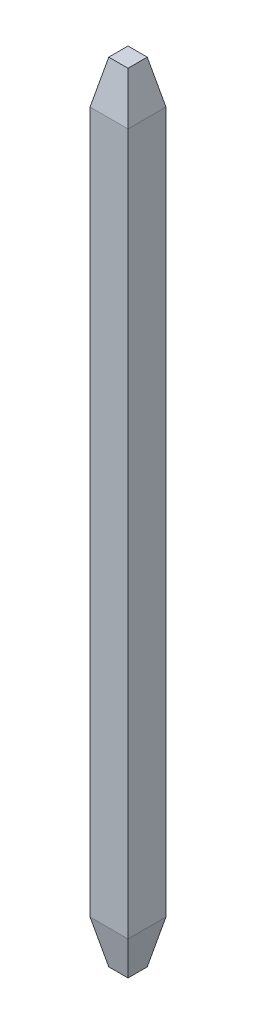
from build123d import *
from OCP.BRepFilletAPI import BRepFilletAPI_MakeChamfer

# Parameters (mm, degrees)
SKETCH1_W           = 0.65
SKETCH1_H           = 0.65
BOSS_EXTRUDE1_DEPTH = 13.5
CHAMFER1_SIZE       = 0.74
CHAMFER1_SIZE2      = 0.16
CHAMFER2_SIZE       = 0.16
CHAMFER2_SIZE2      = 0.74


with BuildPart() as part:
    # Sketch1 → Boss-Extrude1 (new body)
    with BuildSketch(Plane(origin=(0, 0, 0), x_dir=(1, 0, 0), z_dir=(0, 1, 0))):
        with Locations((0.325, 0.325)):
            Rectangle(SKETCH1_W, SKETCH1_H)
    extrude(amount=BOSS_EXTRUDE1_DEPTH)

    # Chamfer1: one chamfer whose edges measure the first distance from different faces: ONE call of the kernel's chamfer builder (chamfer() names one face for all edges)
    chamfer1_edges_1 = [part.edges().sort_by_distance(p)[0] for p in [
        (0.65, 13.5, -0.325),
    ]]
    chamfer1_side_1 = [part.faces().sort_by_distance(p)[0] for p in [
        (0.65, 6.75, -0.325),
    ]]
    chamfer1_edges_2 = [part.edges().sort_by_distance(p)[0] for p in [
        (0.325, 13.5, -0.65),
    ]]
    chamfer1_side_2 = [part.faces().sort_by_distance(p)[0] for p in [
        (0.325, 6.75, -0.65),
    ]]
    chamfer1_edges_3 = [part.edges().sort_by_distance(p)[0] for p in [
        (0, 13.5, -0.325),
    ]]
    chamfer1_side_3 = [part.faces().sort_by_distance(p)[0] for p in [
        (0, 6.75, -0.325),
    ]]
    chamfer1_edges_4 = [part.edges().sort_by_distance(p)[0] for p in [
        (0.325, 13.5, 0),
    ]]
    chamfer1_side_4 = [part.faces().sort_by_distance(p)[0] for p in [
        (0.325, 6.75, 0),
    ]]
    chamfer1 = BRepFilletAPI_MakeChamfer(part.part.solid().wrapped)
    for e in chamfer1_edges_1:
        chamfer1.Add(CHAMFER1_SIZE, CHAMFER1_SIZE2, e.wrapped, chamfer1_side_1[0].wrapped)  # the first distance lies on this face
    for e in chamfer1_edges_2:
        chamfer1.Add(CHAMFER1_SIZE, CHAMFER1_SIZE2, e.wrapped, chamfer1_side_2[0].wrapped)  # the first distance lies on this face
    for e in chamfer1_edges_3:
        chamfer1.Add(CHAMFER1_SIZE, CHAMFER1_SIZE2, e.wrapped, chamfer1_side_3[0].wrapped)  # the first distance lies on this face
    for e in chamfer1_edges_4:
        chamfer1.Add(CHAMFER1_SIZE, CHAMFER1_SIZE2, e.wrapped, chamfer1_side_4[0].wrapped)  # the first distance lies on this face
    add(Compound.cast(chamfer1.Shape()), mode=Mode.REPLACE)

    # Chamfer2
    chamfer2_edges = [part.edges().sort_by_distance(p)[0] for p in [
        (0.325, 0, -0.65),
        (0.65, 0, -0.325),
        (0.325, 0, 0),
        (0, 0, -0.325),
    ]]
    chamfer2_side = [part.faces().sort_by_distance(p)[0] for p in [
        (0.325, 0, -0.325),
    ]]
    chamfer(chamfer2_edges, length=CHAMFER2_SIZE, length2=CHAMFER2_SIZE2, reference=chamfer2_side[0])


solid = part.part
